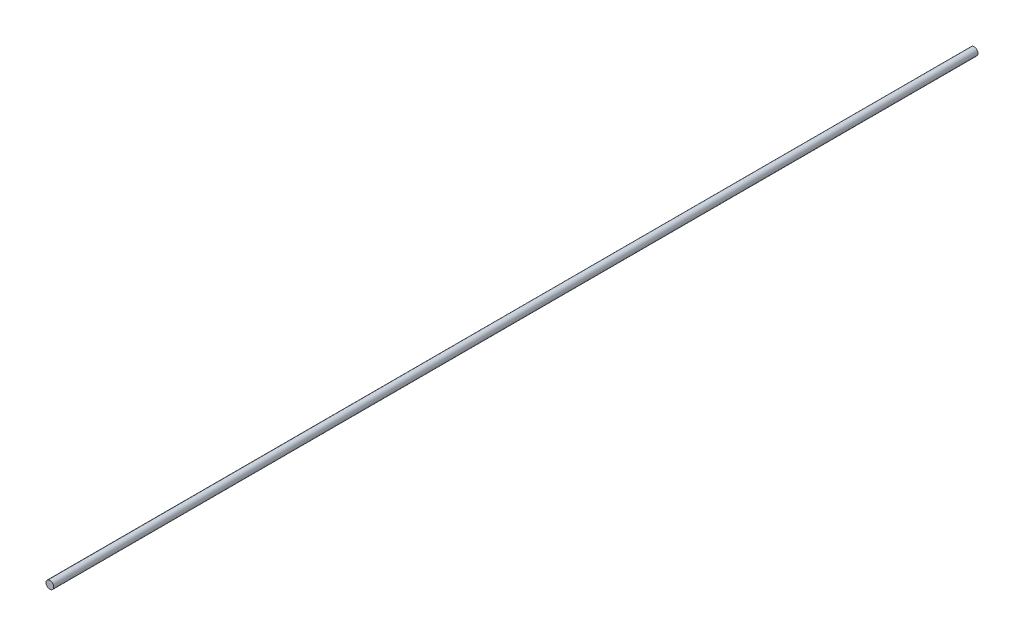
from build123d import *

# Parameters (mm, degrees)
SKETCH1_R           = 1.5
BOSS_EXTRUDE1_DEPTH = 360


with BuildPart() as part:
    # Sketch1 → Boss-Extrude1 (new body)
    with BuildSketch(Plane.XY):
        Circle(SKETCH1_R)
    extrude(amount=BOSS_EXTRUDE1_DEPTH)


solid = part.part
